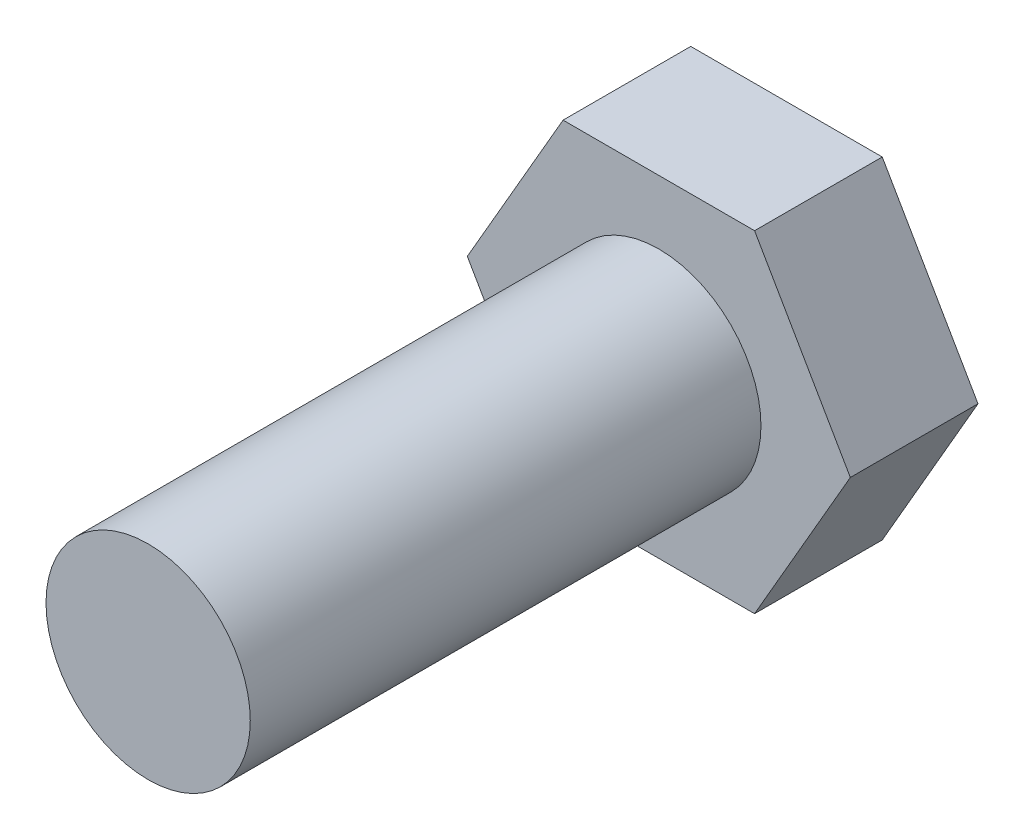
from build123d import *

# Parameters (mm, degrees)
EXTRUDE_1_DEPTH     = 10
SKETCH_2_R          = 8
EXTRUDE_2_DEPTH     = 50
SKETCH_3_R          = 4
CUT_EXTRUDE_2_DEPTH = 15


with BuildPart() as part:
    # 草图1 → 凸台-拉伸1 (new body)
    with BuildSketch(Plane.XY):
        Polygon((15, 0), (7.5, 12.990381057), (-7.5, 12.990381057), (-15, 0), (-7.5, -12.990381057), (7.5, -12.990381057), align=None)
    extrude(amount=EXTRUDE_1_DEPTH)

    # 草图2 → 凸台-拉伸2 (add)
    with BuildSketch(Plane.XY):
        Circle(SKETCH_2_R)
    extrude(amount=EXTRUDE_2_DEPTH)

    # 草图3 → 切除-拉伸2 (cut)
    with BuildSketch(Plane.XY):
        Circle(SKETCH_3_R)
    extrude(amount=CUT_EXTRUDE_2_DEPTH, mode=Mode.SUBTRACT)


solid = part.part
